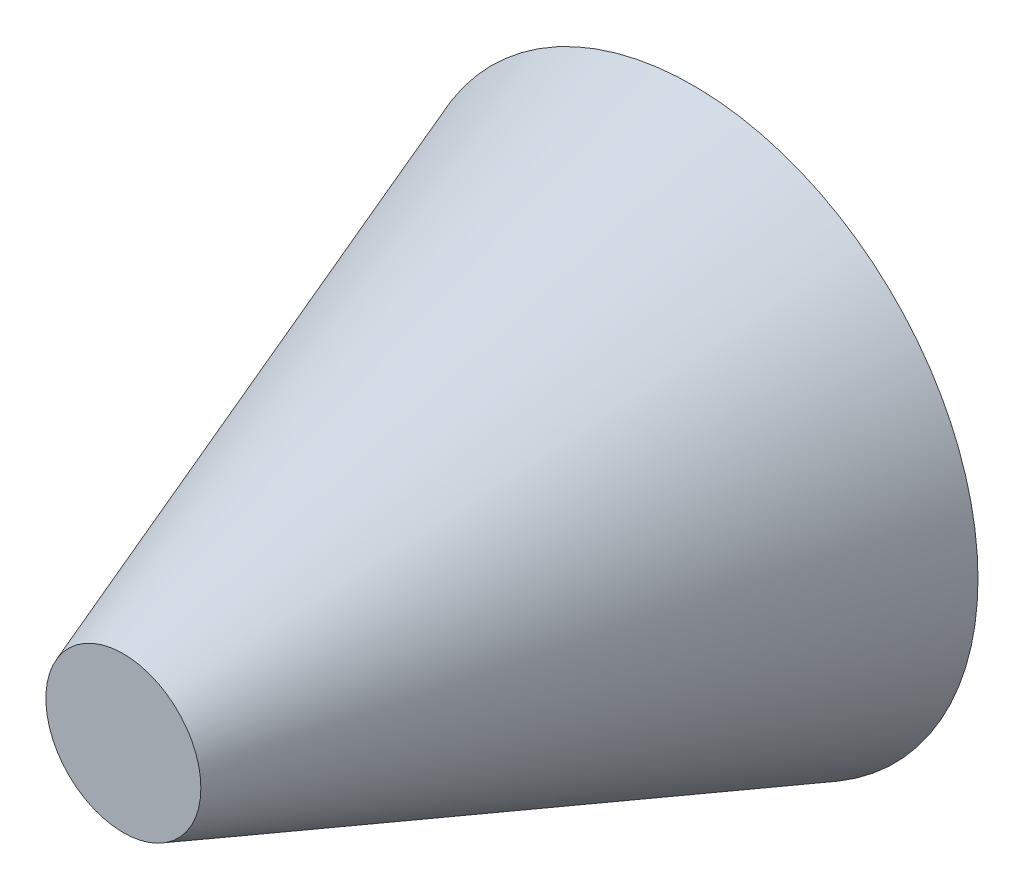
from build123d import *

# Parameters (mm, degrees)
SKETCH1_R           = 508
BOSS_EXTRUDE1_DEPTH = 1016
BOSS_EXTRUDE1_TAPER = 20


with BuildPart() as part:
    # Sketch1 → Boss-Extrude1 (new body)
    with BuildSketch(Plane.XY):
        Circle(SKETCH1_R)
    extrude(amount=BOSS_EXTRUDE1_DEPTH, taper=BOSS_EXTRUDE1_TAPER)


solid = part.part
